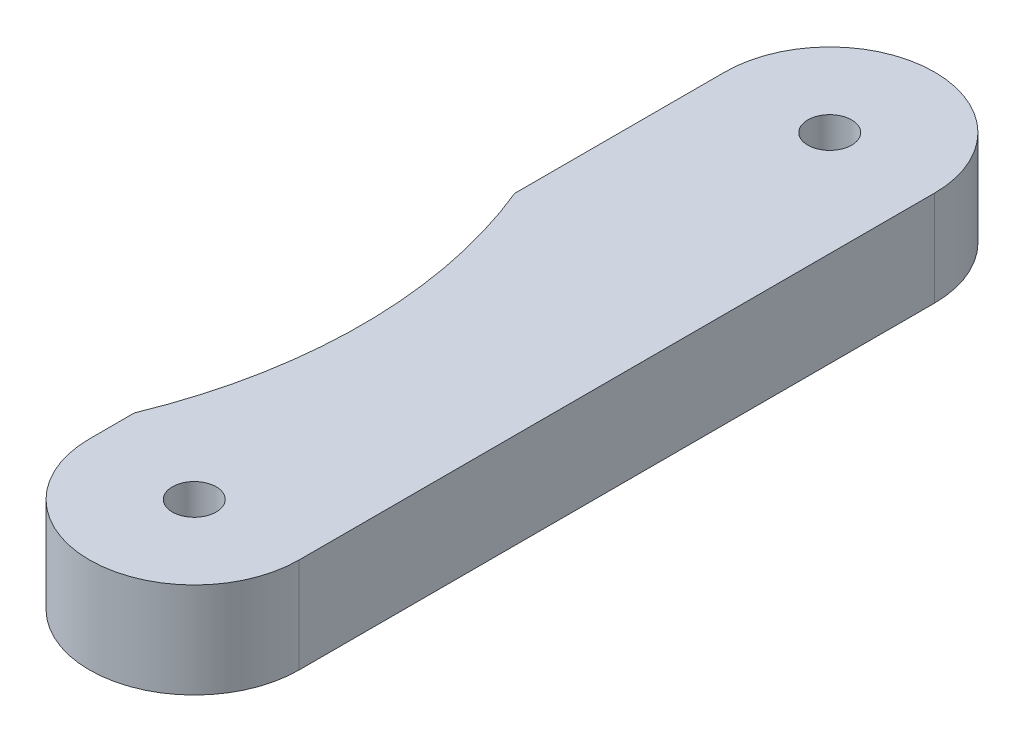
from build123d import *

# Parameters (mm, degrees)
BOSS_EXTRUDE1_DEPTH   = 3.81
F_4_40_TAPPED_HOLE1_D = 1.7526
CUT_EXTRUDE1_DEPTH    = 25.948437705


with BuildPart() as part:
    # Sketch1 → Boss-Extrude1 (new body)
    with BuildSketch(Plane(origin=(0, 0, 0), x_dir=(1, 0, 0), z_dir=(0, 1, 0))):
        with BuildLine():
            Line((0.307655172, 6.517241379), (0.307655172, -18.882758621))
            ThreePointArc((0.307655172, -18.882758621), (4.498655172, -23.073758621), (8.689655172, -18.882758621))
            Line((8.689655172, -18.882758621), (8.689655172, 6.517241379))
            ThreePointArc((8.689655172, 6.517241379), (4.498655172, 10.708241379), (0.307655172, 6.517241379))
        make_face()
    extrude(amount=BOSS_EXTRUDE1_DEPTH)

    # #4-40 Tapped Hole1 (through all)
    with Locations(Plane(origin=(0, 3.81, 0), x_dir=(1, 0, 0), z_dir=(0, 1, 0))):
        with Locations((4.498655172, 6.517241379), (4.498655172, -18.882758621)):
            Hole(F_4_40_TAPPED_HOLE1_D / 2)

    # Sketch4 → Cut-Extrude1 (cut, through all)
    with BuildSketch(Plane(origin=(0, 3.81, 0), x_dir=(1, 0, 0), z_dir=(0, 1, 0))):
        with BuildLine():
            Line((0.307655172, -17.084100697), (0.307655172, -1.885416544))
            ThreePointArc((0.307655172, -1.885416544), (1.807655172, -9.484758621), (0.307655172, -17.084100697))
        make_face()
    extrude(amount=-CUT_EXTRUDE1_DEPTH, mode=Mode.SUBTRACT)


solid = part.part
